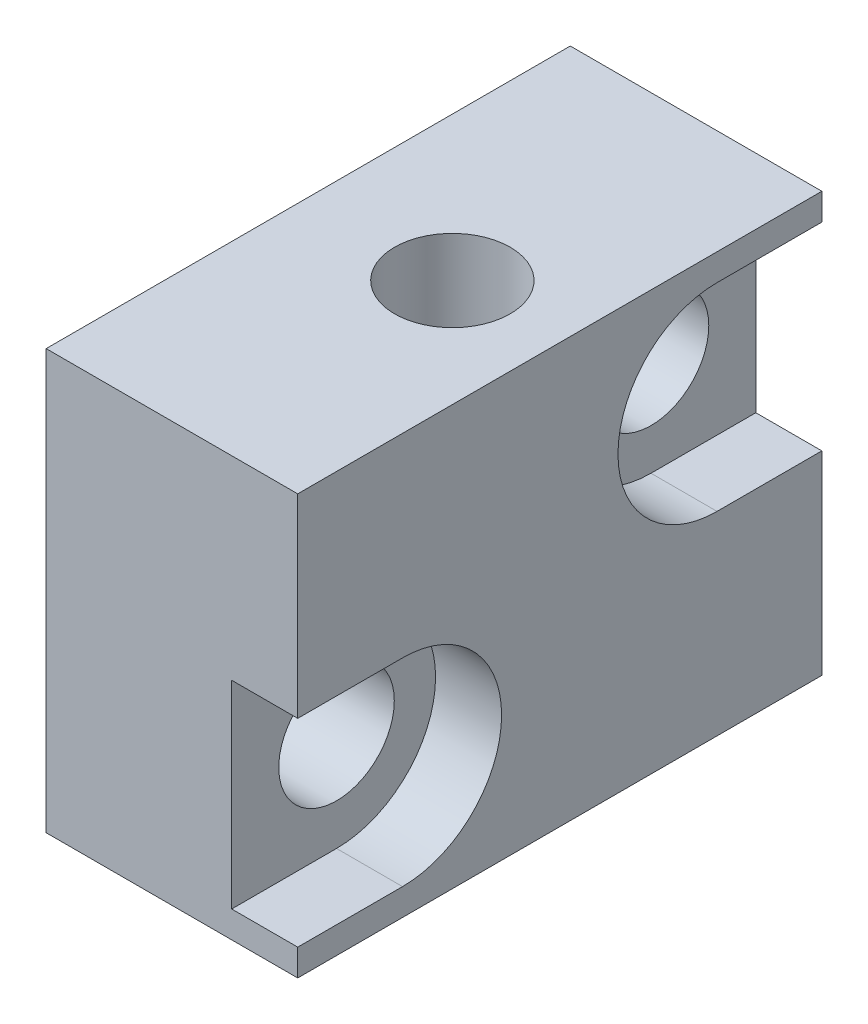
from build123d import *

# Parameters (mm, degrees)
SKETCH1_W           = 12.7
SKETCH1_H           = 15.875
BOSS_EXTRUDE1_DEPTH = 7.62
SKETCH3_R           = 1.75
CUT_EXTRUDE1_DEPTH  = 22.2885
SKETCH4_R           = 1.75
CUT_EXTRUDE2_DEPTH  = 22.2885
SKETCH5_R           = 1.75
CUT_EXTRUDE3_DEPTH  = 2


with BuildPart() as part:
    # Sketch1 → Boss-Extrude1 (new body)
    with BuildSketch(Plane.YZ):
        Rectangle(SKETCH1_W, SKETCH1_H)
    extrude(amount=BOSS_EXTRUDE1_DEPTH)

    # Sketch3 → Cut-Extrude1 (cut)
    with BuildSketch(Plane.XZ.offset(6.35)):
        with Locations((4.36625, 0)):
            Circle(SKETCH3_R)
    extrude(amount=-CUT_EXTRUDE1_DEPTH, mode=Mode.SUBTRACT)

    # Sketch4 → Cut-Extrude2 (cut)
    with BuildSketch(Plane.YZ.offset(7.62)):
        with Locations((-2.54, 4.7625)):
            Circle(SKETCH4_R)
        with Locations((2.54, -4.7625)):
            Circle(SKETCH4_R)
    extrude(amount=-CUT_EXTRUDE2_DEPTH, mode=Mode.SUBTRACT)

    # Sketch5 → Cut-Extrude3 (cut)
    # profile 1 of 2: a face of its own
    with BuildSketch(Plane.YZ.offset(7.62)):
        with BuildLine():
            Line((-5.54, 7.9375), (-5.54, 4.7625))
            ThreePointArc((-5.54, 4.7625), (-2.54, 1.7625), (0.46, 4.7625))
            Line((0.46, 4.7625), (0.46, 7.9375))
            Line((0.46, 7.9375), (-5.54, 7.9375))
        make_face()
        with Locations((-2.54, 4.7625)):
            Circle(SKETCH5_R, mode=Mode.SUBTRACT)
    # profile 2 of 2: a face of its own
    with BuildSketch(Plane.YZ.offset(7.62)):
        with BuildLine():
            ThreePointArc((5.54, -4.7625), (2.54, -1.7625), (-0.46, -4.7625))
            Line((-0.46, -4.7625), (-0.46, -7.9375))
            Line((-0.46, -7.9375), (5.54, -7.9375))
            Line((5.54, -7.9375), (5.54, -4.7625))
        make_face()
        with Locations((2.54, -4.7625)):
            Circle(SKETCH5_R, mode=Mode.SUBTRACT)
    extrude(amount=-CUT_EXTRUDE3_DEPTH, mode=Mode.SUBTRACT)


solid = part.part
